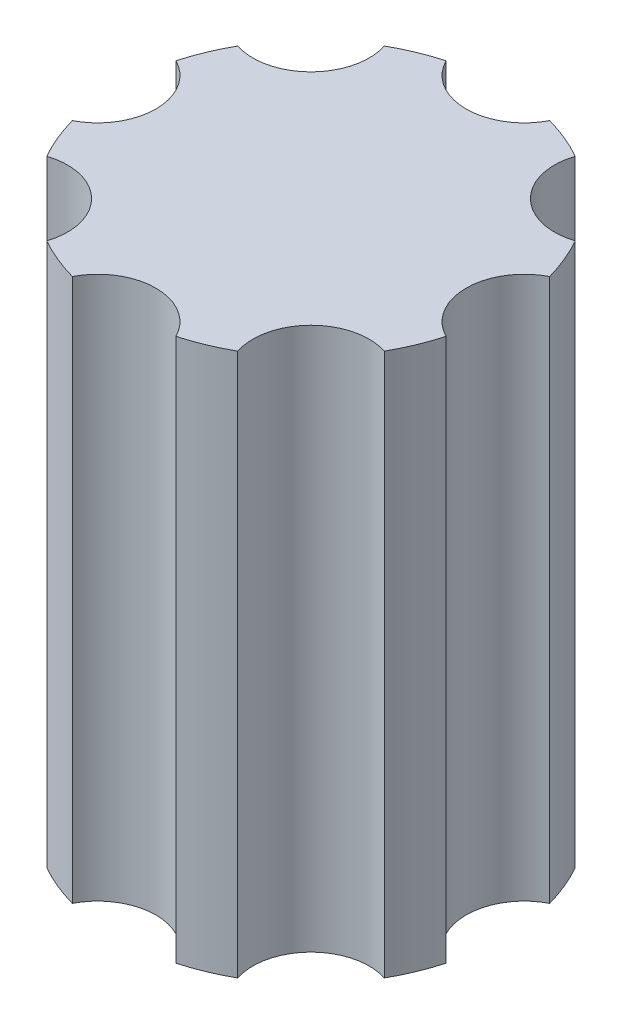
from build123d import *

# Parameters (mm, degrees)
ESQUISSE1_R                  = 5
BOSS_EXTRU_1_DEPTH           = 12
ESQUISSE2_R                  = 5
BOSS_EXTRU_2_DEPTH           = 2
ESQUISSE3_R                  = 1.5
ENL_V_MAT_EXTRU_1_DEPTH      = 14
R_P_TITION_CIRCULAIRE1_COUNT = 8


with BuildPart() as part:
    # Esquisse1 → Boss.-Extru.1 (new body)
    with BuildSketch(Plane(origin=(0, 0, 0), x_dir=(1, 0, 0), z_dir=(0, 1, 0))):
        with Locations(Location((0, 0, 0), (0, 0, 270))):
            Circle(ESQUISSE1_R)
        with BuildLine():
            Line((2.236067977, -2), (-2.236067977, -2))
            ThreePointArc((-2.236067977, -2), (0, 3), (2.236067977, -2))
        make_face(mode=Mode.SUBTRACT)
    extrude(amount=BOSS_EXTRU_1_DEPTH)

    # Esquisse2 → Boss.-Extru.2 (add)
    with BuildSketch(Plane(origin=(0, 12, 0), x_dir=(1, 0, 0), z_dir=(0, 1, 0))):
        with Locations(Location((0, 0, 0), (0, 0, 270))):
            Circle(ESQUISSE2_R)
    extrude(amount=BOSS_EXTRU_2_DEPTH)

    # Esquisse3 → Enlèv. mat.-Extru.1 (cut)
    with BuildSketch(Plane(origin=(0, 14, 0), x_dir=(1, 0, 0), z_dir=(0, 1, 0))):
        with Locations((0, 5.5)):
            Circle(ESQUISSE3_R)
    enl_v_mat_extru_1 = extrude(amount=-ENL_V_MAT_EXTRU_1_DEPTH, mode=Mode.SUBTRACT)

    # Répétition circulaire1: Enlèv. mat.-Extru.1 ×8 about axis
    r_p_tition_circulaire1_axis = Axis((0, 0, 0), (0, 1, 0))
    for i in range(1, R_P_TITION_CIRCULAIRE1_COUNT):
        add(enl_v_mat_extru_1.rotate(r_p_tition_circulaire1_axis, i * 360 / R_P_TITION_CIRCULAIRE1_COUNT), mode=Mode.SUBTRACT)


solid = part.part
